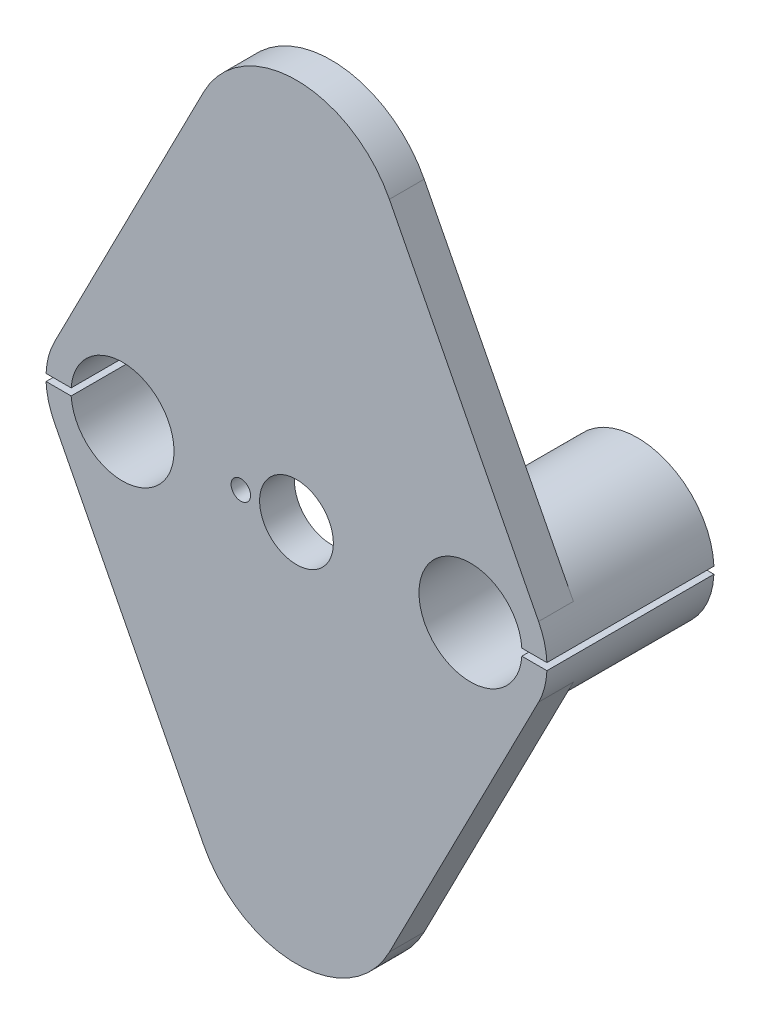
from build123d import *

# Parameters (mm, degrees)
SKETCH1_R               = 5.3
BOSS_EXTRUDE1_DEPTH     = 5
BOSS_EXTRUDE2_START     = 19
SKETCH2_R               = 11
BOSS_EXTRUDE2_DEPTH     = 19
CUT_EXTRUDE1_REACH      = 120.203
SKETCH3_R               = 7.4
CUT_EXTRUDE2_REACH      = 134.834
CUT_EXTRUDE2_END_RADIUS = 7.4
SKETCH6_W               = 24
SKETCH6_H               = 1
CUT_EXTRUDE3_REACH      = 120.2
SKETCH4_R               = 1.4


with BuildPart() as part:
    # Sketch1 → Boss-Extrude1 (new body)
    with BuildSketch(Plane.XY):
        with BuildLine():
            Line((-34.788764, 60.017978), (-13.348315, 101.842697))
            ThreePointArc((-13.348315, 101.842697), (0, 110), (13.348315, 101.842697))
            Line((13.348315, 101.842697), (34.788764, 60.017978))
            ThreePointArc((34.788764, 60.017978), (36, 55), (34.788764, 49.982022))
            Line((34.788764, 49.982022), (13.348315, 8.157303))
            ThreePointArc((13.348315, 8.157303), (0, 0), (-13.348315, 8.157303))
            Line((-13.348315, 8.157303), (-34.788764, 49.982022))
            ThreePointArc((-34.788764, 49.982022), (-36, 55), (-34.788764, 60.017978))
        make_face()
        with Locations((0, 55)):
            Circle(SKETCH1_R, mode=Mode.SUBTRACT)
    extrude(amount=BOSS_EXTRUDE1_DEPTH)

    # Sketch2 → Boss-Extrude2 (add)
    with BuildSketch(Plane(origin=(0, 0, 0), x_dir=(-1, 0, 0), z_dir=(0, 0, -1)).offset(BOSS_EXTRUDE2_START)):
        with Locations((-25, 55)):
            Circle(SKETCH2_R)
        with Locations((25, 55)):
            Circle(SKETCH2_R)
    extrude(amount=-BOSS_EXTRUDE2_DEPTH)

    # Sketch3 → Cut-Extrude1 (cut, up to next)
    with BuildSketch(Plane(origin=(0, 0, -19), x_dir=(-1, 0, 0), z_dir=(0, 0, -1)), mode=Mode.PRIVATE) as cut_extrude1_sk1:
        with Locations((-25, 55)):
            Circle(SKETCH3_R)
    cut_extrude1_tool1 = extrude(cut_extrude1_sk1.sketch, amount=-CUT_EXTRUDE1_REACH, mode=Mode.PRIVATE) & part.part
    # Sketch3 → Cut-Extrude1 (cut, up to next)
    with BuildSketch(Plane(origin=(0, 0, -19), x_dir=(-1, 0, 0), z_dir=(0, 0, -1)), mode=Mode.PRIVATE) as cut_extrude1_sk2:
        with Locations((25, 55)):
            Circle(SKETCH3_R)
    cut_extrude1_tool2 = extrude(cut_extrude1_sk2.sketch, amount=-CUT_EXTRUDE1_REACH, mode=Mode.PRIVATE) & part.part
    add(cut_extrude1_tool1.solids().sort_by_distance((25, 55, -19))[0], mode=Mode.SUBTRACT)
    add(cut_extrude1_tool2.solids().sort_by_distance((-25, 55, -19))[0], mode=Mode.SUBTRACT)

    # Cut-Extrude2: up to this cylinder (the profile starts outside it)
    cut_extrude2_end = Plane(origin=(25, 55, -7), z_dir=(0, 0, -1)) * Cylinder(CUT_EXTRUDE2_END_RADIUS, 285.468, mode=Mode.PRIVATE)
    # Sketch6 → Cut-Extrude2 (cut, up to the surface)
    with BuildSketch(Plane(origin=(36, 0, 0), x_dir=(0, 0, -1), z_dir=(1, 0, 0)), mode=Mode.PRIVATE) as cut_extrude2_sk1:
        with Locations((7, 55)):
            Rectangle(SKETCH6_W, SKETCH6_H)
    cut_extrude2_tool1 = extrude(cut_extrude2_sk1.sketch, amount=-CUT_EXTRUDE2_REACH, mode=Mode.PRIVATE) - cut_extrude2_end
    cut_extrude2 = cut_extrude2_tool1.solids().sort_by_distance((36, 55, -7))[0]
    add(cut_extrude2, mode=Mode.SUBTRACT)

    # Mirror1: Cut-Extrude2 across plane
    add(cut_extrude2.mirror(Plane(origin=(0, 0, 0), x_dir=(0, 0, 1), z_dir=(1, 0, 0))), mode=Mode.SUBTRACT)

    # Sketch4 → Cut-Extrude3 (cut, up to next)
    with BuildSketch(Plane.XY.offset(5), mode=Mode.PRIVATE) as cut_extrude3_sk1:
        with Locations((-8, 55)):
            Circle(SKETCH4_R)
    cut_extrude3_tool1 = extrude(cut_extrude3_sk1.sketch, amount=-CUT_EXTRUDE3_REACH, mode=Mode.PRIVATE) & part.part
    add(cut_extrude3_tool1.solids().sort_by_distance((-8, 55, 5))[0], mode=Mode.SUBTRACT)


solid = part.part
